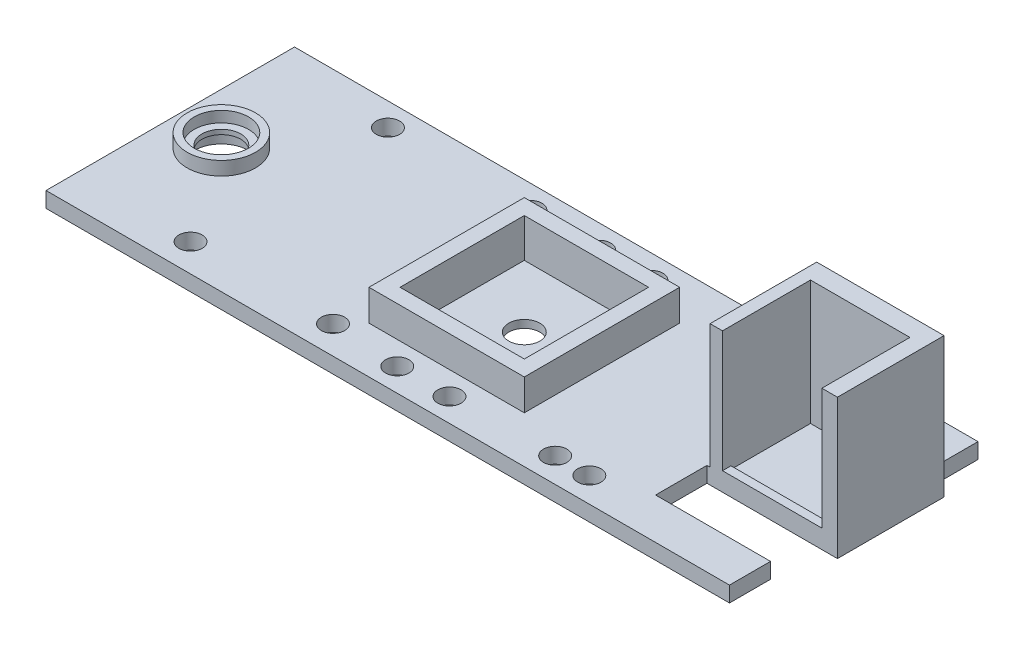
from build123d import *

# Parameters (mm, degrees)
SKETCH1_W            = 279.4
SKETCH1_H            = 101.6
BOSS_EXTRUDE1_DEPTH  = 6.35
SKETCH2_R            = 13.97
BOSS_EXTRUDE3_DEPTH  = 5.55625
SKETCH9_R            = 11.1125
CUT_EXTRUDE4_DEPTH   = 4.445
CUT_EXTRUDE5_START   = -5.55625
SKETCH10_R           = 11.1125
CUT_EXTRUDE5_DEPTH   = 5.55625
SKETCH11_R           = 7.9375
CUT_EXTRUDE6_DEPTH   = 285.078633923
SKETCH12_R           = 6.35
CUT_EXTRUDE7_DEPTH   = 285.051619429
SKETCH22_W           = 63.5
SKETCH22_H           = 63.5
BOSS_EXTRUDE7_DEPTH  = 12.7
SKETCH25_W           = 50.8
SKETCH25_H           = 50.8
CUT_EXTRUDE11_DEPTH  = 15.875
SKETCH32_R           = 4.7625
CUT_EXTRUDE12_DEPTH  = 6.35
SKETCH38_W           = 46.99
SKETCH38_H           = 18.470251096
CUT_EXTRUDE13_DEPTH  = 6.35
SKETCH60_R           = 4.7625
CUT_EXTRUDE23_DEPTH  = 6.35
SKETCH64_R           = 4.7625
CUT_EXTRUDE24_DEPTH  = 285.264471927
SKETCH65_W           = 52.07
SKETCH65_H           = 43.596758628
BOSS_EXTRUDE8_DEPTH  = 50.8
SKETCH68_W           = 43.596758628
SKETCH68_H           = 6.35
BOSS_EXTRUDE10_DEPTH = 6.35
SKETCH66_W           = 40.64
SKETCH66_H           = 32.500000024
CUT_EXTRUDE28_DEPTH  = 50.8
SKETCH69_W           = 40.64
SKETCH69_H           = 49.53
CUT_EXTRUDE29_DEPTH  = 292.497724665
SKETCH70_W           = 46.99
SKETCH70_H           = 2.529758466
CUT_EXTRUDE30_DEPTH  = 289.488543967


with BuildPart() as part:
    # Sketch1 → Boss-Extrude1 (new body)
    with BuildSketch(Plane(origin=(0, 0, 0), x_dir=(1, 0, 0), z_dir=(0, 1, 0))):
        with Locations((-139.7, 0)):
            Rectangle(SKETCH1_W, SKETCH1_H)
    extrude(amount=BOSS_EXTRUDE1_DEPTH)

    # Sketch2 → Boss-Extrude3 (add)
    with BuildSketch(Plane(origin=(0, 6.35, 0), x_dir=(1, 0, 0), z_dir=(0, 1, 0))):
        with Locations(Location((-258.510557857, 0, 0), (0, 0, 90))):
            Circle(SKETCH2_R)
    extrude(amount=BOSS_EXTRUDE3_DEPTH)

    # Sketch9 → Cut-Extrude4 (cut)
    with BuildSketch(Plane(origin=(0, 11.90625, 0), x_dir=(1, 0, 0), z_dir=(0, 1, 0))):
        with Locations(Location((-258.510557857, 0, 0), (0, 0, 270))):
            Circle(SKETCH9_R)
    extrude(amount=-CUT_EXTRUDE4_DEPTH, mode=Mode.SUBTRACT)

    # Sketch10 → Cut-Extrude5 (cut)
    with BuildSketch(Plane(origin=(0, 0, 0), x_dir=(-1, 0, 0), z_dir=(0, -1, 0)).offset(CUT_EXTRUDE5_START)):
        with Locations(Location((258.510557857, 0, 0), (0, 0, 270))):
            Circle(SKETCH10_R)
    extrude(amount=CUT_EXTRUDE5_DEPTH, mode=Mode.SUBTRACT)

    # Sketch11 → Cut-Extrude6 (cut, through all)
    with BuildSketch(Plane(origin=(0, 7.46125, 0), x_dir=(1, 0, 0), z_dir=(0, 1, 0))):
        with Locations(Location((-258.510557857, 0, 0), (0, 0, 270))):
            Circle(SKETCH11_R)
    extrude(amount=-CUT_EXTRUDE6_DEPTH, mode=Mode.SUBTRACT)

    # Sketch12 → Cut-Extrude7 (cut, through all)
    with BuildSketch(Plane(origin=(0, 6.35, 0), x_dir=(1, 0, 0), z_dir=(0, 1, 0))):
        with Locations(Location((-134.666203771, 0, 0), (0, 0, 270))):
            Circle(SKETCH12_R)
    extrude(amount=-CUT_EXTRUDE7_DEPTH, mode=Mode.SUBTRACT)

    # Sketch22 → Boss-Extrude7 (add)
    with BuildSketch(Plane(origin=(0, 6.35, 0), x_dir=(1, 0, 0), z_dir=(0, 1, 0))):
        with Locations((-134.666203771, 0)):
            Rectangle(SKETCH22_W, SKETCH22_H)
    extrude(amount=BOSS_EXTRUDE7_DEPTH)

    # Sketch25 → Cut-Extrude11 (cut)
    with BuildSketch(Plane(origin=(0, 19.05, 0), x_dir=(1, 0, 0), z_dir=(0, 1, 0))):
        with Locations((-134.666203771, 0)):
            Rectangle(SKETCH25_W, SKETCH25_H)
    extrude(amount=-CUT_EXTRUDE11_DEPTH, mode=Mode.SUBTRACT)

    # Sketch32 → Cut-Extrude12 (cut)
    with BuildSketch(Plane(origin=(0, 6.35, 0), x_dir=(1, 0, 0), z_dir=(0, 1, 0))):
        with Locations(Location((-67.44195898, -40.64, 0), (0, 0, 270))):
            Circle(SKETCH32_R)
        with Locations(Location((-81.41195898, -40.64, 0), (0, 0, 270))):
            Circle(SKETCH32_R)
        with Locations(Location((-67.44195898, 40.64, 0), (0, 0, 270))):
            Circle(SKETCH32_R)
        with Locations(Location((-81.41195898, 40.64, 0), (0, 0, 270))):
            Circle(SKETCH32_R)
    extrude(amount=-CUT_EXTRUDE12_DEPTH, mode=Mode.SUBTRACT)

    # Sketch38 → Cut-Extrude13 (cut)
    with BuildSketch(Plane(origin=(0, 6.35, 0), x_dir=(1, 0, 0), z_dir=(0, 1, 0))):
        with Locations((-23.495, -24.777709652)):
            Rectangle(SKETCH38_W, SKETCH38_H)
    extrude(amount=-CUT_EXTRUDE13_DEPTH, mode=Mode.SUBTRACT)

    # Sketch60 → Cut-Extrude23 (cut)
    with BuildSketch(Plane(origin=(0, 6.35, 0), x_dir=(1, 0, 0), z_dir=(0, 1, 0))):
        with Locations(Location((-231.7492444, 41.324145444, 0), (0, 0, 270))):
            Circle(SKETCH60_R)
        with Locations(Location((-231.7492444, -39.369341378, 0), (0, 0, 270))):
            Circle(SKETCH60_R)
        with Locations(Location((-173.509244294, -39.369341378, 0), (0, 0, 270))):
            Circle(SKETCH60_R)
        with Locations(Location((-173.509244294, 41.324145444, 0), (0, 0, 270))):
            Circle(SKETCH60_R)
    extrude(amount=-CUT_EXTRUDE23_DEPTH, mode=Mode.SUBTRACT)

    # Sketch64 → Cut-Extrude24 (cut, through all)
    with BuildSketch(Plane(origin=(0, 6.35, 0), x_dir=(1, 0, 0), z_dir=(0, 1, 0))):
        with Locations(Location((-145.334203771, -41.275, 0), (0, 0, 270))):
            Circle(SKETCH64_R)
        with Locations(Location((-123.998203771, -41.275, 0), (0, 0, 270))):
            Circle(SKETCH64_R)
    cut_extrude24 = extrude(amount=-CUT_EXTRUDE24_DEPTH, mode=Mode.SUBTRACT)

    # Mirror1: Cut-Extrude24 across plane
    add(cut_extrude24.mirror(Plane.XY), mode=Mode.SUBTRACT)

    # Sketch65 → Boss-Extrude8 (add)
    with BuildSketch(Plane(origin=(0, 6.35, 0), x_dir=(1, 0, 0), z_dir=(0, 1, 0))):
        with Locations((-19.685, 8.785553676)):
            Rectangle(SKETCH65_W, SKETCH65_H)
    extrude(amount=BOSS_EXTRUDE8_DEPTH)

    # Sketch68 → Boss-Extrude10 (add)
    with BuildSketch(Plane(origin=(0, 0, 0), x_dir=(0, 0, -1), z_dir=(1, 0, 0))):
        with Locations((8.785553676, 3.175)):
            Rectangle(SKETCH68_W, SKETCH68_H)
    extrude(amount=BOSS_EXTRUDE10_DEPTH)

    # Sketch66 → Cut-Extrude28 (cut)
    with BuildSketch(Plane(origin=(0, 57.15, 0), x_dir=(1, 0, 0), z_dir=(0, 1, 0))):
        with Locations((-20.32, 6.713932978)):
            Rectangle(SKETCH66_W, SKETCH66_H)
    extrude(amount=-CUT_EXTRUDE28_DEPTH, mode=Mode.SUBTRACT)

    # Sketch69 → Cut-Extrude29 (cut, through all)
    with BuildSketch(Plane(origin=(0, 0, 9.536067034), x_dir=(-1, 0, 0), z_dir=(0, 0, -1))):
        with Locations((20.32, 32.385)):
            Rectangle(SKETCH69_W, SKETCH69_H)
    extrude(amount=-CUT_EXTRUDE29_DEPTH, mode=Mode.SUBTRACT)

    # Sketch70 → Cut-Extrude30 (cut, through all)
    with BuildSketch(Plane(origin=(0, 6.35, 0), x_dir=(1, 0, 0), z_dir=(0, 1, 0))):
        with Locations((-23.495, -14.277704871)):
            Rectangle(SKETCH70_W, SKETCH70_H)
    extrude(amount=-CUT_EXTRUDE30_DEPTH, mode=Mode.SUBTRACT)


solid = part.part
